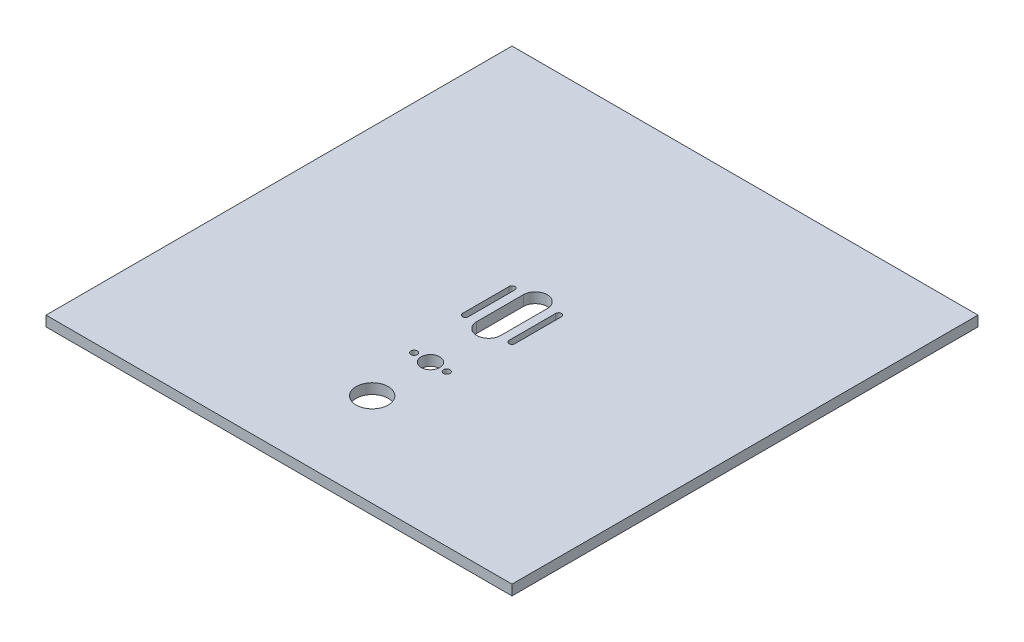
from build123d import *

# Parameters (mm, degrees)
SKETCH1_W           = 254
SKETCH1_H           = 254
BOSS_EXTRUDE1_DEPTH = 5.588
SKETCH2_R           = 8.73125
SKETCH2_R_2         = 5.08
SKETCH2_R_3         = 1.778
CUT_EXTRUDE1_DEPTH  = 180.692030274


with BuildPart() as part:
    # Sketch1 → Boss-Extrude1 (new body)
    with BuildSketch(Plane(origin=(0, 0, 0), x_dir=(1, 0, 0), z_dir=(0, 1, 0))):
        Rectangle(SKETCH1_W, SKETCH1_H)
    extrude(amount=BOSS_EXTRUDE1_DEPTH)

    # Sketch2 → Cut-Extrude1 (cut, through all)
    with BuildSketch(Plane(origin=(0, 5.588, 0), x_dir=(1, 0, 0), z_dir=(0, 1, 0))):
        with Locations(Location((0, -76.2, 0), (0, 0, 270))):
            Circle(SKETCH2_R)
        with Locations(Location((0, -44.45, 0), (0, 0, 270))):
            Circle(SKETCH2_R_2)
        with Locations(Location((-8.89, -44.45, 0), (0, 0, 270))):
            Circle(SKETCH2_R_3)
        with Locations(Location((8.89, -44.45, 0), (0, 0, 270))):
            Circle(SKETCH2_R_3)
        with BuildLine():
            Line((6.5405, 12.7), (6.5405, -12.7))
            ThreePointArc((6.5405, -12.7), (0, -19.2405), (-6.5405, -12.7))
            Line((-6.5405, -12.7), (-6.5405, 12.7))
            ThreePointArc((-6.5405, 12.7), (0, 19.2405), (6.5405, 12.7))
        make_face()
        with BuildLine():
            Line((-11.1125, 12.7), (-11.1125, -12.7))
            ThreePointArc((-11.1125, -12.7), (-12.7, -14.2875), (-14.2875, -12.7))
            Line((-14.2875, -12.7), (-14.2875, 12.7))
            ThreePointArc((-14.2875, 12.7), (-12.7, 14.2875), (-11.1125, 12.7))
        make_face()
        with BuildLine():
            Line((14.2875, 12.7), (14.2875, -12.7))
            ThreePointArc((14.2875, -12.7), (12.7, -14.2875), (11.1125, -12.7))
            Line((11.1125, -12.7), (11.1125, 12.7))
            ThreePointArc((11.1125, 12.7), (12.7, 14.2875), (14.2875, 12.7))
        make_face()
    extrude(amount=-CUT_EXTRUDE1_DEPTH, mode=Mode.SUBTRACT)


solid = part.part
